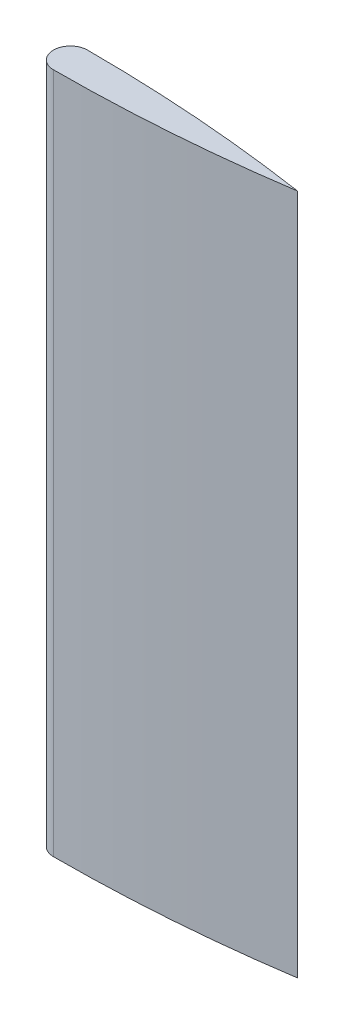
from build123d import *

# Parameters (mm, degrees)
BOSS_EXTRUDE1_DEPTH = 180


with BuildPart() as part:
    # Sketch1 → Boss-Extrude1 (new body)
    with BuildSketch(Plane(origin=(0, 0, 0), x_dir=(1, 0, 0), z_dir=(0, 1, 0))):
        with BuildLine():
            ThreePointArc((0, 4.5), (-4.5, 0), (0, -4.5))
            ThreePointArc((0, -4.5), (30.08425668, -3.373422403), (60, 0))
            ThreePointArc((60, 0), (30.08425668, 3.373422403), (0, 4.5))
        make_face()
    extrude(amount=BOSS_EXTRUDE1_DEPTH)


solid = part.part
